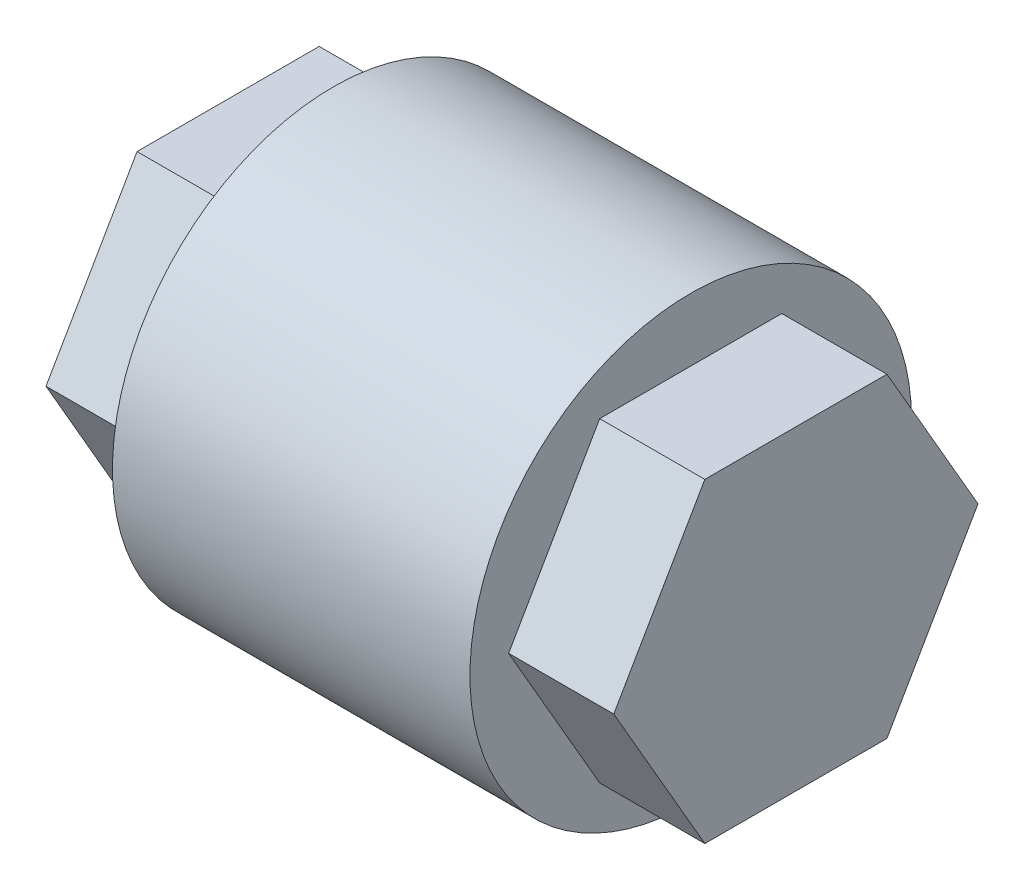
from build123d import *

# Parameters (mm, degrees)
EXTRUDE_305_DEPTH = 10
SKETCH_2_R        = 21
EXTRUDE_1_DEPTH   = 34
EXTRUDE_2_DEPTH   = 10


with BuildPart() as part:
    # Эскиз1 → Extrude 305 (new body)
    with BuildSketch(Plane(origin=(0, 0, 0), x_dir=(0, 0, -1), z_dir=(1, 0, 0))):
        Polygon((17.320508076, 0), (8.660254038, 15), (-8.660254038, 15), (-17.320508076, 0), (-8.660254038, -15), (8.660254038, -15), align=None)
    extrude(amount=EXTRUDE_305_DEPTH)

    # Эскиз2 → Бобышка-Вытянуть1 (add)
    with BuildSketch(Plane(origin=(10, 0, 0), x_dir=(0, 0, -1), z_dir=(1, 0, 0))):
        Circle(SKETCH_2_R)
    extrude(amount=EXTRUDE_1_DEPTH)

    # Эскиз3 → Бобышка-Вытянуть2 (add)
    with BuildSketch(Plane(origin=(44, 0, 0), x_dir=(0, 0, -1), z_dir=(1, 0, 0))):
        Polygon((17.320508076, 0), (8.660254038, 15), (-8.660254038, 15), (-17.320508076, 0), (-8.660254038, -15), (8.660254038, -15), align=None)
    extrude(amount=EXTRUDE_2_DEPTH)


solid = part.part
